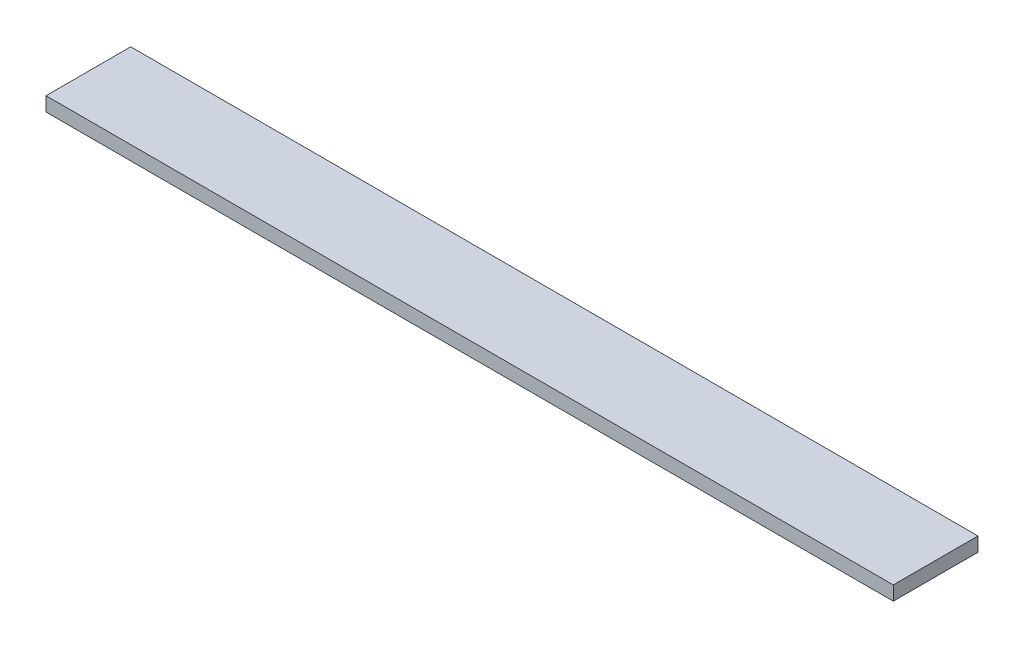
from build123d import *

# Parameters (mm, degrees)
SKETCH1_W           = 600
SKETCH1_H           = 60
BOSS_EXTRUDE1_DEPTH = 10


with BuildPart() as part:
    # Sketch1 → Boss-Extrude1 (new body)
    with BuildSketch(Plane(origin=(0, 0, 0), x_dir=(1, 0, 0), z_dir=(0, 1, 0))):
        with Locations((300, -30)):
            Rectangle(SKETCH1_W, SKETCH1_H)
    extrude(amount=BOSS_EXTRUDE1_DEPTH)


solid = part.part
